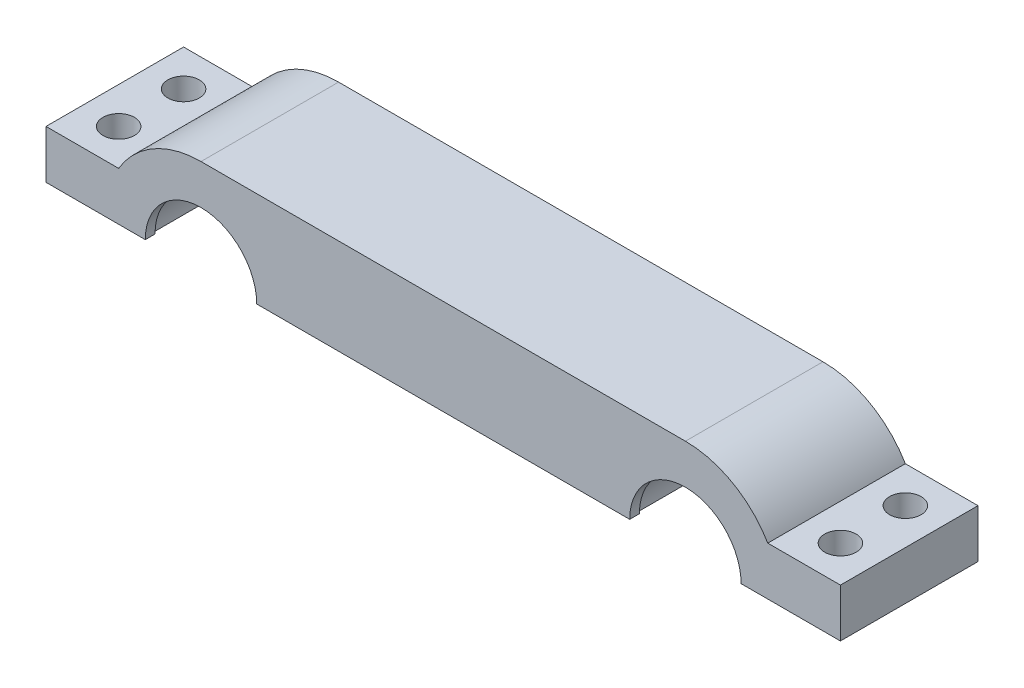
from build123d import *

# Parameters (mm, degrees)
SKETCH1_W           = 82
SKETCH1_H           = 25
BOSS_EXTRUDE1_DEPTH = 14.2
CUT_EXTRUDE3_DEPTH  = 14.2
BOSS_EXTRUDE2_DEPTH = 1
BOSS_EXTRUDE3_START = -13.2
BOSS_EXTRUDE3_DEPTH = 1
CUT_EXTRUDE4_START  = -4.5
CUT_EXTRUDE4_DEPTH  = 3.25
CUT_EXTRUDE5_DEPTH  = 4.5
CUT_EXTRUDE6_DEPTH  = 14.2
SKETCH8_R           = 1.625
CUT_EXTRUDE7_DEPTH  = 5


with BuildPart() as part:
    # Sketch1 → Boss-Extrude1 (new body)
    with BuildSketch(Plane.XY):
        with Locations((0, 12.5)):
            Rectangle(SKETCH1_W, SKETCH1_H)
    extrude(amount=BOSS_EXTRUDE1_DEPTH)

    # Sketch2 → Cut-Extrude3 (cut)
    with BuildSketch(Plane(origin=(0, 0, 0), x_dir=(-1, 0, 0), z_dir=(0, 0, -1))):
        with BuildLine():
            Line((-31, 0), (-19, 0))
            ThreePointArc((-19, 0), (-25, 6), (-31, 0))
        make_face()
        with BuildLine():
            Line((19, 0), (31, 0))
            ThreePointArc((31, 0), (25, 6), (19, 0))
        make_face()
    extrude(amount=-CUT_EXTRUDE3_DEPTH, mode=Mode.SUBTRACT)

    # Sketch4 → Boss-Extrude2 (add)
    with BuildSketch(Plane(origin=(0, 0, 0), x_dir=(-1, 0, 0), z_dir=(0, 0, -1))):
        with BuildLine():
            Line((-30.75, 0), (-31, 0))
            ThreePointArc((-31, 0), (-25, 6), (-19, 0))
            Line((-19, 0), (-19.25, 0))
            ThreePointArc((-19.25, 0), (-25, 5.75), (-30.75, 0))
        make_face()
        with BuildLine():
            Line((19, 0), (19.25, 0))
            ThreePointArc((19.25, 0), (25, 5.75), (30.75, 0))
            Line((30.75, 0), (31, 0))
            ThreePointArc((31, 0), (25, 6), (19, 0))
        make_face()
    extrude(amount=-BOSS_EXTRUDE2_DEPTH)

    # Sketch4<2> → Boss-Extrude3 (add)
    with BuildSketch(Plane(origin=(0, 0, 0), x_dir=(-1, 0, 0), z_dir=(0, 0, -1)).offset(BOSS_EXTRUDE3_START)):
        with BuildLine():
            Line((-30.75, 0), (-31, 0))
            ThreePointArc((-31, 0), (-25, 6), (-19, 0))
            Line((-19, 0), (-19.25, 0))
            ThreePointArc((-19.25, 0), (-25, 5.75), (-30.75, 0))
        make_face()
        with BuildLine():
            Line((19, 0), (19.25, 0))
            ThreePointArc((19.25, 0), (25, 5.75), (30.75, 0))
            Line((30.75, 0), (31, 0))
            ThreePointArc((31, 0), (25, 6), (19, 0))
        make_face()
    extrude(amount=-BOSS_EXTRUDE3_DEPTH)

    # Sketch5 → Cut-Extrude4 (cut)
    with BuildSketch(Plane(origin=(0, 0, 0), x_dir=(-1, 0, 0), z_dir=(0, 0, -1)).offset(CUT_EXTRUDE4_START)):
        with BuildLine():
            Line((-6.5, 0), (6.5, 0))
            ThreePointArc((6.5, 0), (0, 6.5), (-6.5, 0))
        make_face()
    extrude(amount=-CUT_EXTRUDE4_DEPTH, mode=Mode.SUBTRACT)

    # Sketch6 → Cut-Extrude5 (cut)
    with BuildSketch(Plane(origin=(0, 0, 0), x_dir=(-1, 0, 0), z_dir=(0, 0, -1))):
        with BuildLine():
            Line((-2.625, 0), (2.625, 0))
            ThreePointArc((2.625, 0), (0, 2.625), (-2.625, 0))
        make_face()
    extrude(amount=-CUT_EXTRUDE5_DEPTH, mode=Mode.SUBTRACT)

    # Sketch7 → Cut-Extrude6 (cut)
    with BuildSketch(Plane(origin=(0, 0, 0), x_dir=(-1, 0, 0), z_dir=(0, 0, -1))):
        with BuildLine():
            Line((-41, 5), (-33.5, 5))
            ThreePointArc((-33.5, 5), (-29.896033736, 8.560306867), (-25, 9.861541462))
            Line((-25, 9.861541462), (25, 9.861541462))
            ThreePointArc((25, 9.861541462), (29.896033736, 8.560306867), (33.5, 5))
            Line((33.5, 5), (41, 5))
            Line((41, 5), (41, 25))
            Line((41, 25), (-41, 25))
            Line((-41, 25), (-41, 5))
        make_face()
    extrude(amount=-CUT_EXTRUDE6_DEPTH, mode=Mode.SUBTRACT)

    # Sketch8 → Cut-Extrude7 (cut)
    with BuildSketch(Plane(origin=(0, 5, 0), x_dir=(1, 0, 0), z_dir=(0, 1, 0))):
        with Locations(Location((37.25, -3.75, 0), (0, 0, 270))):
            Circle(SKETCH8_R)
        with Locations(Location((37.25, -10.45, 0), (0, 0, 270))):
            Circle(SKETCH8_R)
        with Locations(Location((-37.25, -3.75, 0), (0, 0, 270))):
            Circle(SKETCH8_R)
        with Locations(Location((-37.25, -10.45, 0), (0, 0, 270))):
            Circle(SKETCH8_R)
    extrude(amount=-CUT_EXTRUDE7_DEPTH, mode=Mode.SUBTRACT)


solid = part.part
